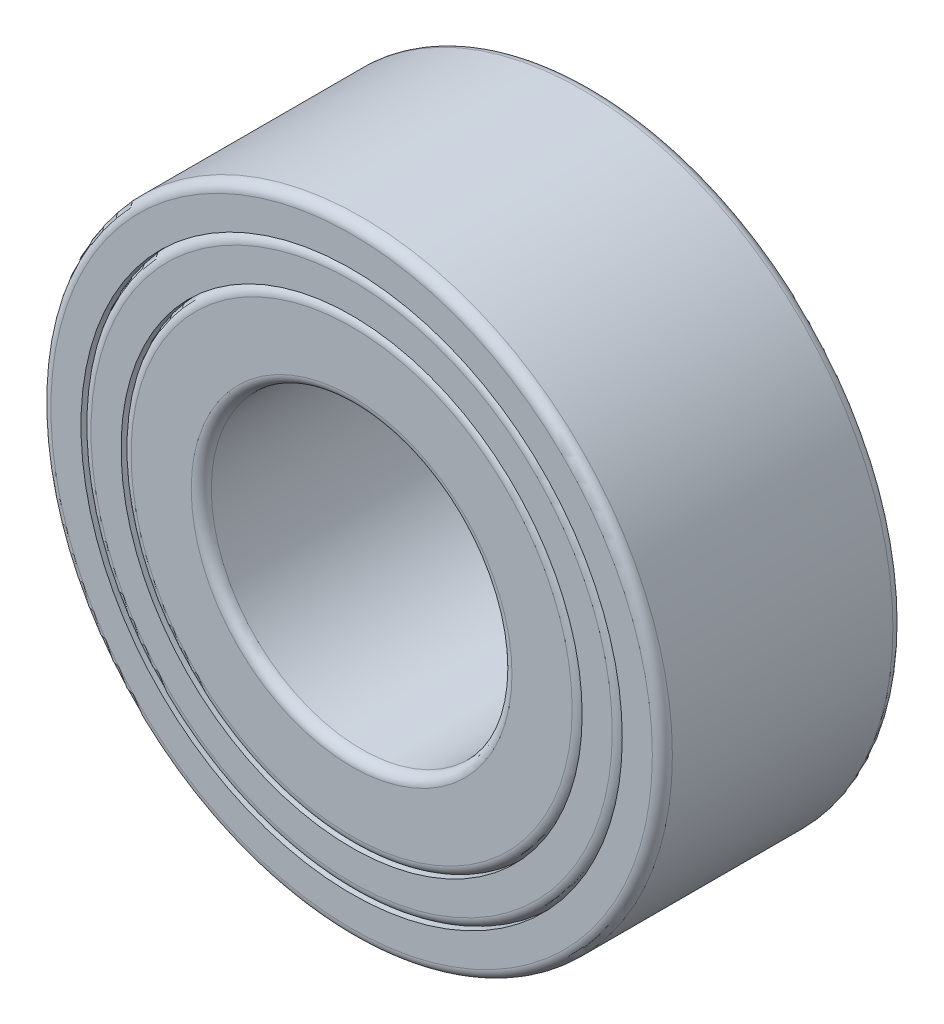
from build123d import *

# Parameters (mm, degrees)
SKETCH1_R           = 23
SKETCH1_R_2         = 15
BOSS_EXTRUDE1_DEPTH = 24
FILLET1_R           = 1
SKETCH2_R           = 27
SKETCH2_R_2         = 23
BOSS_EXTRUDE2_DEPTH = 24
FILLET2_R           = 1
SKETCH3_R           = 31
SKETCH3_R_2         = 27
BOSS_EXTRUDE3_DEPTH = 24
FILLET3_R           = 1
FILLET4_R           = 1


with BuildPart() as part:
    # Sketch1 → Boss-Extrude1 (new body)
    with BuildSketch(Plane.XY):
        Circle(SKETCH1_R)
        Circle(SKETCH1_R_2, mode=Mode.SUBTRACT)
    extrude(amount=BOSS_EXTRUDE1_DEPTH)

    # Fillet1
    fillet1_edges = [part.edges().sort_by_distance(p)[0] for p in [
        (-23, 0, 0),
        (-23, 0, 24),
    ]]
    fillet(fillet1_edges, radius=FILLET1_R)

    # Sketch2 → Boss-Extrude2 (add)
    with BuildSketch(Plane.XY):
        Circle(SKETCH2_R)
        Circle(SKETCH2_R_2, mode=Mode.SUBTRACT)
    extrude(amount=BOSS_EXTRUDE2_DEPTH)

    # Fillet2
    fillet2_edges = [part.edges().sort_by_distance(p)[0] for p in [
        (-27, 0, 24),
        (-27, 0, 0),
    ]]
    fillet(fillet2_edges, radius=FILLET2_R)

    # Sketch3 → Boss-Extrude3 (add)
    with BuildSketch(Plane.XY):
        Circle(SKETCH3_R)
        Circle(SKETCH3_R_2, mode=Mode.SUBTRACT)
    extrude(amount=BOSS_EXTRUDE3_DEPTH)

    # Fillet3
    fillet3_edges = [part.edges().sort_by_distance(p)[0] for p in [
        (-31, 0, 24),
        (-31, 0, 0),
    ]]
    fillet(fillet3_edges, radius=FILLET3_R)

    # Fillet4
    fillet4_edges = [part.edges().sort_by_distance(p)[0] for p in [
        (-15, 0, 0),
        (-15, 0, 24),
    ]]
    fillet(fillet4_edges, radius=FILLET4_R)


solid = part.part
